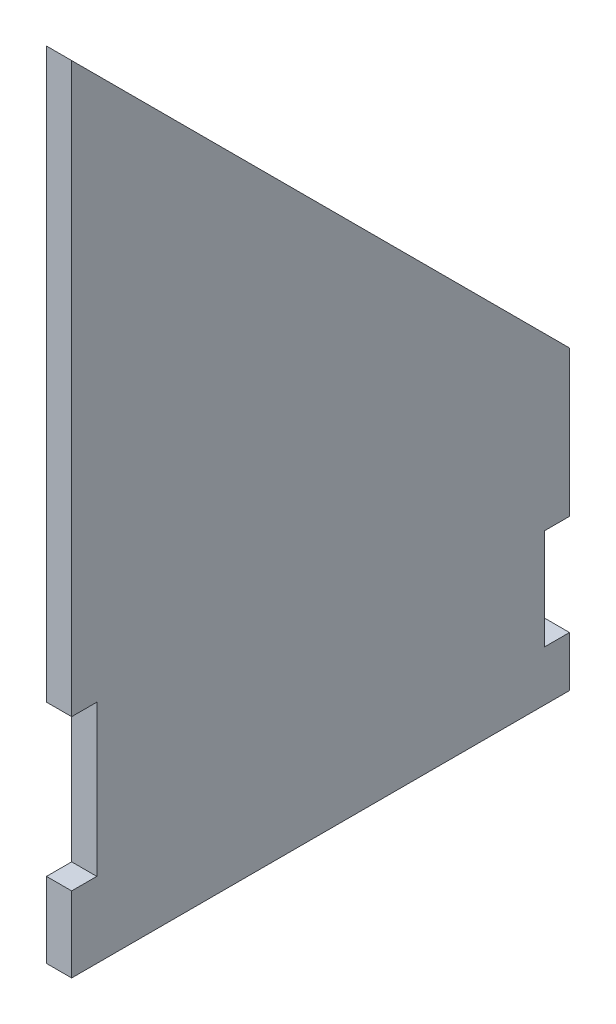
from build123d import *

# Parameters (mm, degrees)
EXTRUDE_1_DEPTH     = 5
SKETCH_3_W          = 5
SKETCH_3_H          = 30
SKETCH_3_H_2        = 20
CUT_EXTRUDE_2_DEPTH = 10


with BuildPart() as part:
    # 스케치1 → 보스-돌출1 (new body)
    with BuildSketch(Plane(origin=(0, 0, 0), x_dir=(0, 0, -1), z_dir=(1, 0, 0))):
        Polygon((0, 0), (98.994949366, 0), (98.994949366, 59), (0, 157.994949366), align=None)
    extrude(amount=EXTRUDE_1_DEPTH)

    # 스케치3 → 컷-돌출2 (cut)
    with BuildSketch(Plane(origin=(5, 0, 0), x_dir=(0, 0, -1), z_dir=(1, 0, 0))):
        with Locations((2.5, 30)):
            Rectangle(SKETCH_3_W, SKETCH_3_H)
        with Locations((96.494949366, 20)):
            Rectangle(SKETCH_3_W, SKETCH_3_H_2)
    extrude(amount=-CUT_EXTRUDE_2_DEPTH, mode=Mode.SUBTRACT)


solid = part.part
